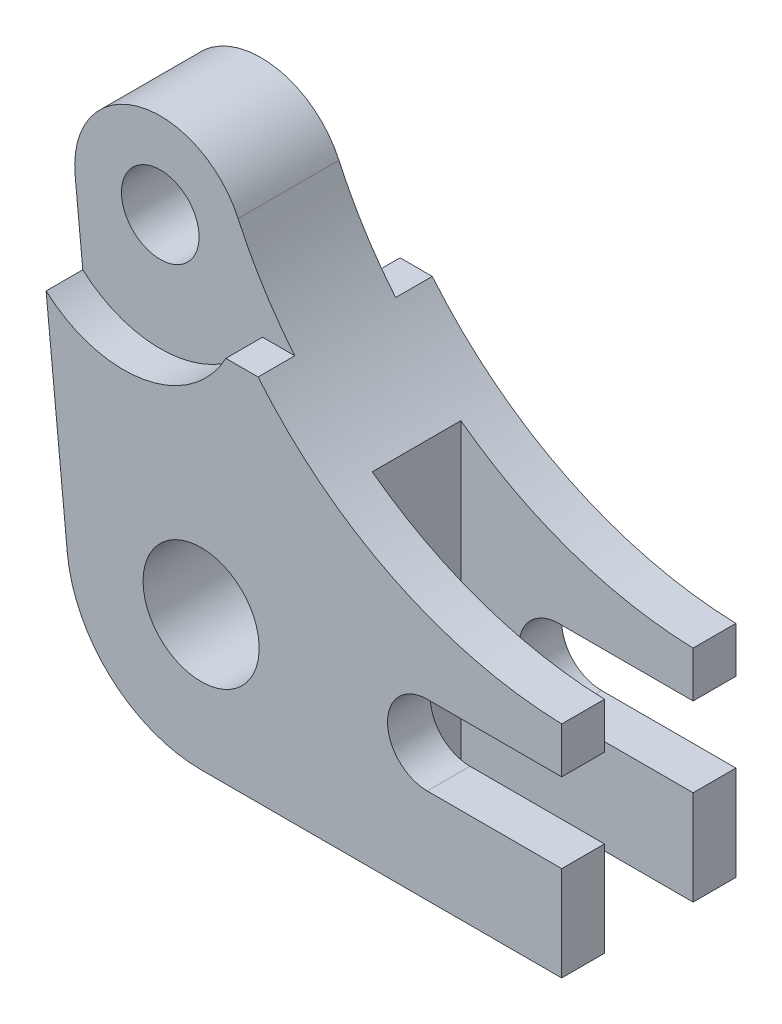
from build123d import *

# Parameters (mm, degrees)
ESQUISSE1_R                  = 9.5
ESQUISSE1_R_2                = 6.35
BOSS_EXTRU_1_DEPTH           = 14.25
ENL_V_MAT_EXTRU_1_DEPTH      = 6
ENL_V_MAT_EXTRU_2_DEPTH      = 7.25
ENL_V_MAT_EXTRU_2_DEPTH_BACK = 7.25


with BuildPart() as part:
    # Esquisse1 → Boss.-Extru.1 (new, symmetric)
    with BuildSketch(Plane.XY):
        with BuildLine():
            Line((-26.61523279, 45.963348263), (-21.894870769, -2.148169925))
            ThreePointArc((-21.894870769, -2.148169925), (-14.777351956, -16.298155392), (0, -22))
            Line((0, -22), (59, -22))
            Line((59, -22), (59, -6.5))
            Line((59, -6.5), (37, -6.5))
            ThreePointArc((37, -6.5), (30.5, 0), (37, 6.5))
            Line((37, 6.5), (59, 6.5))
            Line((59, 6.5), (59, 14))
            ThreePointArc((59, 14), (23.937620364, 25.155899787), (0.053417306, 53.144636986))
            ThreePointArc((0.053417306, 53.144636986), (-16.322360933, 60.848824799), (-26.61523279, 45.963348263))
        make_face()
        with Locations(Location((0, 0, 0), (0, 0, 180))):
            Circle(ESQUISSE1_R, mode=Mode.SUBTRACT)
        with Locations(Location((-12.68213321, 47.330365488, 0), (0, 0, 180))):
            Circle(ESQUISSE1_R_2, mode=Mode.SUBTRACT)
    extrude(amount=BOSS_EXTRU_1_DEPTH, both=True)

    # Esquisse2 → Enlèv. mat.-Extru.1 (cut)
    with BuildSketch(Plane.XY.offset(14.25)):
        with BuildLine():
            Line((4.051067321, 38.330365488), (9.321809703, 38.330365488))
            ThreePointArc((9.321809703, 38.330365488), (4.202566317, 45.434036591), (0.053417306, 53.144636986))
            ThreePointArc((0.053417306, 53.144636986), (-16.322360933, 60.848824799), (-26.61523279, 45.963348263))
            Line((-26.61523279, 45.963348263), (-25.360971776, 33.179497931))
            ThreePointArc((-25.360971776, 33.179497931), (-9.404585059, 28.615193084), (4.051067321, 38.330365488))
        make_face()
    enl_v_mat_extru_1 = extrude(amount=-ENL_V_MAT_EXTRU_1_DEPTH, mode=Mode.SUBTRACT)

    # Symétrie1: Enlèv. mat.-Extru.1 across plane
    add(enl_v_mat_extru_1.mirror(Plane.XY), mode=Mode.SUBTRACT)

    # Esquisse3 → Enlèv. mat.-Extru.2 (cut, two sides: drawn at the far end of the back side and taken through both)
    with BuildSketch(Plane.XY.offset(-ENL_V_MAT_EXTRU_2_DEPTH_BACK)):
        with BuildLine():
            Line((21, -22), (21, 27.222240802))
            ThreePointArc((21, 27.222240802), (38.984037644, 17.691299917), (59, 14))
            Line((59, 14), (59, -22))
            Line((59, -22), (21, -22))
        make_face()
    extrude(amount=ENL_V_MAT_EXTRU_2_DEPTH + ENL_V_MAT_EXTRU_2_DEPTH_BACK, mode=Mode.SUBTRACT)


solid = part.part
